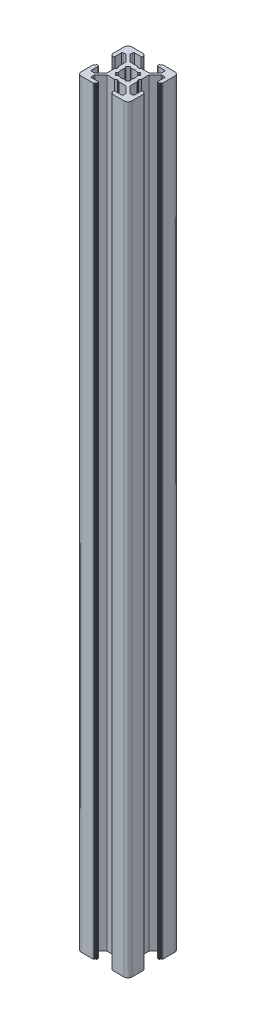
from build123d import *

# Parameters (mm, degrees)
BOSS_EXTRUDE1_DEPTH = 150


with BuildPart() as part:
    # Sketch2 → Boss-Extrude1 (new, symmetric)
    with BuildSketch(Plane(origin=(0, 0, 0), x_dir=(1, 0, 0), z_dir=(0, 1, 0))):
        with BuildLine():
            Line((-10, 3.75), (-10, 8.5))
            ThreePointArc((-10, 8.5), (-9.560660172, 9.560660172), (-8.5, 10))
            Line((-8.5, 10), (-3.75, 10))
            ThreePointArc((-3.75, 10), (-3.608578644, 9.941421356), (-3.55, 9.8))
            Line((-3.55, 9.8), (-3.55, 9.7))
            ThreePointArc((-3.55, 9.7), (-3.491421356, 9.558578644), (-3.35, 9.5))
            Line((-3.35, 9.5), (-3.2, 9.5))
            ThreePointArc((-3.2, 9.5), (-3.058578644, 9.441421356), (-3, 9.3))
            Line((-3, 9.3), (-3, 8.9))
            ThreePointArc((-3, 8.9), (-3.117157288, 8.617157288), (-3.4, 8.5))
            Line((-3.4, 8.5), (-5.9, 8.5))
            ThreePointArc((-5.9, 8.5), (-6.182842712, 8.382842712), (-6.3, 8.1))
            Line((-6.3, 8.1), (-6.3, 7.172792206))
            ThreePointArc((-6.3, 7.172792206), (-6.269551813, 7.019718833), (-6.182842712, 6.889949494))
            Line((-6.182842712, 6.889949494), (-3.910050506, 4.617157288))
            ThreePointArc((-3.910050506, 4.617157288), (-3.780281167, 4.530448187), (-3.627207794, 4.5))
            Line((-3.627207794, 4.5), (-0.919615242, 4.5))
            ThreePointArc((-0.919615242, 4.5), (-0.867851433, 4.493185165), (-0.819615242, 4.473205081))
            Line((-0.819615242, 4.473205081), (-0.1, 4.057735027))
            ThreePointArc((-0.1, 4.057735027), (0, 4.030940108), (0.1, 4.057735027))
            Line((0.1, 4.057735027), (0.819615242, 4.473205081))
            ThreePointArc((0.819615242, 4.473205081), (0.867851433, 4.493185165), (0.919615242, 4.5))
            Line((0.919615242, 4.5), (3.627207794, 4.5))
            ThreePointArc((3.627207794, 4.5), (3.780281167, 4.530448187), (3.910050506, 4.617157288))
            Line((3.910050506, 4.617157288), (6.182842712, 6.889949494))
            ThreePointArc((6.182842712, 6.889949494), (6.269551813, 7.019718833), (6.3, 7.172792206))
            Line((6.3, 7.172792206), (6.3, 8.1))
            ThreePointArc((6.3, 8.1), (6.182842712, 8.382842712), (5.9, 8.5))
            Line((5.9, 8.5), (3.4, 8.5))
            ThreePointArc((3.4, 8.5), (3.117157288, 8.617157288), (3, 8.9))
            Line((3, 8.9), (3, 9.3))
            ThreePointArc((3, 9.3), (3.058578644, 9.441421356), (3.2, 9.5))
            Line((3.2, 9.5), (3.35, 9.5))
            ThreePointArc((3.35, 9.5), (3.491421356, 9.558578644), (3.55, 9.7))
            Line((3.55, 9.7), (3.55, 9.8))
            ThreePointArc((3.55, 9.8), (3.608578644, 9.941421356), (3.75, 10))
            Line((3.75, 10), (8.5, 10))
            ThreePointArc((8.5, 10), (9.560660172, 9.560660172), (10, 8.5))
            Line((10, 8.5), (10, 3.75))
            ThreePointArc((10, 3.75), (9.941421356, 3.608578644), (9.8, 3.55))
            Line((9.8, 3.55), (9.7, 3.55))
            ThreePointArc((9.7, 3.55), (9.558578644, 3.491421356), (9.5, 3.35))
            Line((9.5, 3.35), (9.5, 3.2))
            ThreePointArc((9.5, 3.2), (9.441421356, 3.058578644), (9.3, 3))
            Line((9.3, 3), (8.9, 3))
            ThreePointArc((8.9, 3), (8.617157288, 3.117157288), (8.5, 3.4))
            Line((8.5, 3.4), (8.5, 5.9))
            ThreePointArc((8.5, 5.9), (8.382842712, 6.182842712), (8.1, 6.3))
            Line((8.1, 6.3), (7.172792206, 6.3))
            ThreePointArc((7.172792206, 6.3), (7.019718833, 6.269551813), (6.889949494, 6.182842712))
            Line((6.889949494, 6.182842712), (4.617157288, 3.910050506))
            ThreePointArc((4.617157288, 3.910050506), (4.530448187, 3.780281167), (4.5, 3.627207794))
            Line((4.5, 3.627207794), (4.5, 0.919615242))
            ThreePointArc((4.5, 0.919615242), (4.493185165, 0.867851433), (4.473205081, 0.819615242))
            Line((4.473205081, 0.819615242), (4.057735027, 0.1))
            ThreePointArc((4.057735027, 0.1), (4.030940108, 0), (4.057735027, -0.1))
            Line((4.057735027, -0.1), (4.473205081, -0.819615242))
            ThreePointArc((4.473205081, -0.819615242), (4.493185165, -0.867851433), (4.5, -0.919615242))
            Line((4.5, -0.919615242), (4.5, -3.627207794))
            ThreePointArc((4.5, -3.627207794), (4.530448187, -3.780281167), (4.617157288, -3.910050506))
            Line((4.617157288, -3.910050506), (6.889949494, -6.182842712))
            ThreePointArc((6.889949494, -6.182842712), (7.019718833, -6.269551813), (7.172792206, -6.3))
            Line((7.172792206, -6.3), (8.1, -6.3))
            ThreePointArc((8.1, -6.3), (8.382842712, -6.182842712), (8.5, -5.9))
            Line((8.5, -5.9), (8.5, -3.4))
            ThreePointArc((8.5, -3.4), (8.617157288, -3.117157288), (8.9, -3))
            Line((8.9, -3), (9.3, -3))
            ThreePointArc((9.3, -3), (9.441421356, -3.058578644), (9.5, -3.2))
            Line((9.5, -3.2), (9.5, -3.35))
            ThreePointArc((9.5, -3.35), (9.558578644, -3.491421356), (9.7, -3.55))
            Line((9.7, -3.55), (9.8, -3.55))
            ThreePointArc((9.8, -3.55), (9.941421356, -3.608578644), (10, -3.75))
            Line((10, -3.75), (10, -8.5))
            ThreePointArc((10, -8.5), (9.560660172, -9.560660172), (8.5, -10))
            Line((8.5, -10), (3.75, -10))
            ThreePointArc((3.75, -10), (3.608578644, -9.941421356), (3.55, -9.8))
            Line((3.55, -9.8), (3.55, -9.7))
            ThreePointArc((3.55, -9.7), (3.491421356, -9.558578644), (3.35, -9.5))
            Line((3.35, -9.5), (3.2, -9.5))
            ThreePointArc((3.2, -9.5), (3.058578644, -9.441421356), (3, -9.3))
            Line((3, -9.3), (3, -8.9))
            ThreePointArc((3, -8.9), (3.117157288, -8.617157288), (3.4, -8.5))
            Line((3.4, -8.5), (5.9, -8.5))
            ThreePointArc((5.9, -8.5), (6.182842712, -8.382842712), (6.3, -8.1))
            Line((6.3, -8.1), (6.3, -7.172792206))
            ThreePointArc((6.3, -7.172792206), (6.269551813, -7.019718833), (6.182842712, -6.889949494))
            Line((6.182842712, -6.889949494), (3.910050506, -4.617157288))
            ThreePointArc((3.910050506, -4.617157288), (3.780281167, -4.530448187), (3.627207794, -4.5))
            Line((3.627207794, -4.5), (0.919615242, -4.5))
            ThreePointArc((0.919615242, -4.5), (0.867851433, -4.493185165), (0.819615242, -4.473205081))
            Line((0.819615242, -4.473205081), (0.1, -4.057735027))
            ThreePointArc((0.1, -4.057735027), (0, -4.030940108), (-0.1, -4.057735027))
            Line((-0.1, -4.057735027), (-0.819615242, -4.473205081))
            ThreePointArc((-0.819615242, -4.473205081), (-0.867851433, -4.493185165), (-0.919615242, -4.5))
            Line((-0.919615242, -4.5), (-3.627207794, -4.5))
            ThreePointArc((-3.627207794, -4.5), (-3.780281167, -4.530448187), (-3.910050506, -4.617157288))
            Line((-3.910050506, -4.617157288), (-6.182842712, -6.889949494))
            ThreePointArc((-6.182842712, -6.889949494), (-6.269551813, -7.019718833), (-6.3, -7.172792206))
            Line((-6.3, -7.172792206), (-6.3, -8.1))
            ThreePointArc((-6.3, -8.1), (-6.182842712, -8.382842712), (-5.9, -8.5))
            Line((-5.9, -8.5), (-3.4, -8.5))
            ThreePointArc((-3.4, -8.5), (-3.117157288, -8.617157288), (-3, -8.9))
            Line((-3, -8.9), (-3, -9.3))
            ThreePointArc((-3, -9.3), (-3.058578644, -9.441421356), (-3.2, -9.5))
            Line((-3.2, -9.5), (-3.35, -9.5))
            ThreePointArc((-3.35, -9.5), (-3.491421356, -9.558578644), (-3.55, -9.7))
            Line((-3.55, -9.7), (-3.55, -9.8))
            ThreePointArc((-3.55, -9.8), (-3.608578644, -9.941421356), (-3.75, -10))
            Line((-3.75, -10), (-8.5, -10))
            ThreePointArc((-8.5, -10), (-9.560660172, -9.560660172), (-10, -8.5))
            Line((-10, -8.5), (-10, -3.75))
            ThreePointArc((-10, -3.75), (-9.941421356, -3.608578644), (-9.8, -3.55))
            Line((-9.8, -3.55), (-9.7, -3.55))
            ThreePointArc((-9.7, -3.55), (-9.558578644, -3.491421356), (-9.5, -3.35))
            Line((-9.5, -3.35), (-9.5, -3.2))
            ThreePointArc((-9.5, -3.2), (-9.441421356, -3.058578644), (-9.3, -3))
            Line((-9.3, -3), (-8.9, -3))
            ThreePointArc((-8.9, -3), (-8.617157288, -3.117157288), (-8.5, -3.4))
            Line((-8.5, -3.4), (-8.5, -5.9))
            ThreePointArc((-8.5, -5.9), (-8.382842712, -6.182842712), (-8.1, -6.3))
            Line((-8.1, -6.3), (-7.172792206, -6.3))
            ThreePointArc((-7.172792206, -6.3), (-7.019718833, -6.269551813), (-6.889949494, -6.182842712))
            Line((-6.889949494, -6.182842712), (-4.617157288, -3.910050506))
            ThreePointArc((-4.617157288, -3.910050506), (-4.530448187, -3.780281167), (-4.5, -3.627207794))
            Line((-4.5, -3.627207794), (-4.5, -0.919615242))
            ThreePointArc((-4.5, -0.919615242), (-4.493185165, -0.867851433), (-4.473205081, -0.819615242))
            Line((-4.473205081, -0.819615242), (-4.057735027, -0.1))
            ThreePointArc((-4.057735027, -0.1), (-4.030940108, 0), (-4.057735027, 0.1))
            Line((-4.057735027, 0.1), (-4.473205081, 0.819615242))
            ThreePointArc((-4.473205081, 0.819615242), (-4.493185165, 0.867851433), (-4.5, 0.919615242))
            Line((-4.5, 0.919615242), (-4.5, 3.627207794))
            ThreePointArc((-4.5, 3.627207794), (-4.530448187, 3.780281167), (-4.617157288, 3.910050506))
            Line((-4.617157288, 3.910050506), (-6.889949494, 6.182842712))
            ThreePointArc((-6.889949494, 6.182842712), (-7.019718833, 6.269551813), (-7.172792206, 6.3))
            Line((-7.172792206, 6.3), (-8.1, 6.3))
            ThreePointArc((-8.1, 6.3), (-8.382842712, 6.182842712), (-8.5, 5.9))
            Line((-8.5, 5.9), (-8.5, 3.4))
            ThreePointArc((-8.5, 3.4), (-8.617157288, 3.117157288), (-8.9, 3))
            Line((-8.9, 3), (-9.3, 3))
            ThreePointArc((-9.3, 3), (-9.441421356, 3.058578644), (-9.5, 3.2))
            Line((-9.5, 3.2), (-9.5, 3.35))
            ThreePointArc((-9.5, 3.35), (-9.558578644, 3.491421356), (-9.7, 3.55))
            Line((-9.7, 3.55), (-9.8, 3.55))
            ThreePointArc((-9.8, 3.55), (-9.941421356, 3.608578644), (-10, 3.75))
        make_face()
        with BuildLine():
            Line((-2.479688955, 1.419028783), (-2.896761999, 1.836101827))
            ThreePointArc((-2.896761999, 1.836101827), (-2.940106295, 1.928880314), (-2.913814922, 2.02785172))
            ThreePointArc((-2.913814922, 2.02785172), (-2.510229073, 2.510229073), (-2.02785172, 2.913814922))
            ThreePointArc((-2.02785172, 2.913814922), (-1.928880314, 2.940106295), (-1.836101827, 2.896761999))
            Line((-1.836101827, 2.896761999), (-1.419028783, 2.479688955))
            ThreePointArc((-1.419028783, 2.479688955), (-1.336531377, 2.437618141), (-1.245050899, 2.452009025))
            ThreePointArc((-1.245050899, 2.452009025), (0, 2.75), (1.245050899, 2.452009025))
            ThreePointArc((1.245050899, 2.452009025), (1.336531377, 2.437618141), (1.419028783, 2.479688955))
            Line((1.419028783, 2.479688955), (1.836101827, 2.896761999))
            ThreePointArc((1.836101827, 2.896761999), (1.928880314, 2.940106295), (2.02785172, 2.913814922))
            ThreePointArc((2.02785172, 2.913814922), (2.510229073, 2.510229073), (2.913814922, 2.02785172))
            ThreePointArc((2.913814922, 2.02785172), (2.940106295, 1.928880314), (2.896761999, 1.836101827))
            Line((2.896761999, 1.836101827), (2.479688955, 1.419028783))
            ThreePointArc((2.479688955, 1.419028783), (2.437618141, 1.336531377), (2.452009025, 1.245050899))
            ThreePointArc((2.452009025, 1.245050899), (2.75, 0), (2.452009025, -1.245050899))
            ThreePointArc((2.452009025, -1.245050899), (2.437618141, -1.336531377), (2.479688955, -1.419028783))
            Line((2.479688955, -1.419028783), (2.896761999, -1.836101827))
            ThreePointArc((2.896761999, -1.836101827), (2.940106295, -1.928880314), (2.913814922, -2.02785172))
            ThreePointArc((2.913814922, -2.02785172), (2.510229073, -2.510229073), (2.02785172, -2.913814922))
            ThreePointArc((2.02785172, -2.913814922), (1.928880314, -2.940106295), (1.836101827, -2.896761999))
            Line((1.836101827, -2.896761999), (1.419028783, -2.479688955))
            ThreePointArc((1.419028783, -2.479688955), (1.336531377, -2.437618141), (1.245050899, -2.452009025))
            ThreePointArc((1.245050899, -2.452009025), (0, -2.75), (-1.245050899, -2.452009025))
            ThreePointArc((-1.245050899, -2.452009025), (-1.336531377, -2.437618141), (-1.419028783, -2.479688955))
            Line((-1.419028783, -2.479688955), (-1.836101827, -2.896761999))
            ThreePointArc((-1.836101827, -2.896761999), (-1.928880314, -2.940106295), (-2.02785172, -2.913814922))
            ThreePointArc((-2.02785172, -2.913814922), (-2.510229073, -2.510229073), (-2.913814922, -2.02785172))
            ThreePointArc((-2.913814922, -2.02785172), (-2.940106295, -1.928880314), (-2.896761999, -1.836101827))
            Line((-2.896761999, -1.836101827), (-2.479688955, -1.419028783))
            ThreePointArc((-2.479688955, -1.419028783), (-2.437618141, -1.336531377), (-2.452009025, -1.245050899))
            ThreePointArc((-2.452009025, -1.245050899), (-2.75, 0), (-2.452009025, 1.245050899))
            ThreePointArc((-2.452009025, 1.245050899), (-2.437618141, 1.336531377), (-2.479688955, 1.419028783))
        make_face(mode=Mode.SUBTRACT)
    extrude(amount=BOSS_EXTRUDE1_DEPTH, both=True)


solid = part.part
